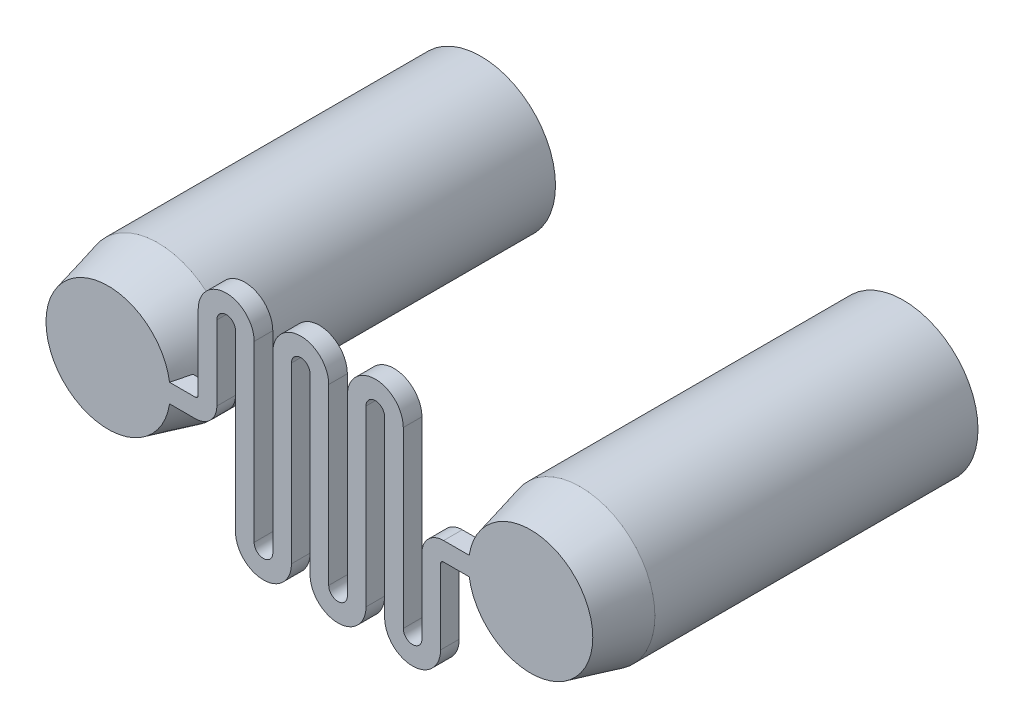
from build123d import *

# Parameters (mm, degrees)
BOSS_EXTRUDE1_DEPTH = 1.5
SKETCH5_R           = 5
CUT_EXTRUDE1_DEPTH  = 28


with BuildPart() as part:
    # Sketch2 → Boss-Extrude1 (new body)
    with BuildSketch(Plane.XY):
        with BuildLine():
            Line((-20.5, -0.75), (-13.5, -0.75))
            ThreePointArc((-13.5, -0.75), (-12.262563133, -0.237436867), (-11.75, 1))
            Line((-11.75, 1), (-11.75, 7))
            ThreePointArc((-11.75, 7), (-11, 7.75), (-10.25, 7))
            Line((-10.25, 7), (-10.25, 0))
            Line((-10.25, 0), (-10.25, -7))
            ThreePointArc((-10.25, -7), (-8, -9.25), (-5.75, -7))
            Line((-5.75, -7), (-5.75, 0))
            Line((-5.75, 0), (-5.75, 7))
            ThreePointArc((-5.75, 7), (-5, 7.75), (-4.25, 7))
            Line((-4.25, 7), (-4.25, 0))
            Line((-4.25, 0), (-4.25, -7))
            ThreePointArc((-4.25, -7), (-2, -9.25), (0.25, -7))
            Line((0.25, -7), (0.25, 0))
            Line((0.25, 0), (0.25, 7))
            ThreePointArc((0.25, 7), (1, 7.75), (1.75, 7))
            Line((1.75, 7), (1.75, 0))
            Line((1.75, 0), (1.75, -7))
            ThreePointArc((1.75, -7), (4, -9.25), (6.25, -7))
            Line((6.25, -7), (6.25, -1))
            ThreePointArc((6.25, -1), (6.323223305, -0.823223305), (6.5, -0.75))
            Line((6.5, -0.75), (13.5, -0.75))
            ThreePointArc((13.5, -0.75), (14.25, 0), (13.5, 0.75))
            Line((13.5, 0.75), (6.5, 0.75))
            ThreePointArc((6.5, 0.75), (5.262563133, 0.237436867), (4.75, -1))
            Line((4.75, -1), (4.75, -7))
            ThreePointArc((4.75, -7), (4, -7.75), (3.25, -7))
            Line((3.25, -7), (3.25, 0))
            Line((3.25, 0), (3.25, 7))
            ThreePointArc((3.25, 7), (1, 9.25), (-1.25, 7))
            Line((-1.25, 7), (-1.25, 0))
            Line((-1.25, 0), (-1.25, -7))
            ThreePointArc((-1.25, -7), (-2, -7.75), (-2.75, -7))
            Line((-2.75, -7), (-2.75, 0))
            Line((-2.75, 0), (-2.75, 7))
            ThreePointArc((-2.75, 7), (-5, 9.25), (-7.25, 7))
            Line((-7.25, 7), (-7.25, 0))
            Line((-7.25, 0), (-7.25, -7))
            ThreePointArc((-7.25, -7), (-8, -7.75), (-8.75, -7))
            Line((-8.75, -7), (-8.75, 0))
            Line((-8.75, 0), (-8.75, 7))
            ThreePointArc((-8.75, 7), (-11, 9.25), (-13.25, 7))
            Line((-13.25, 7), (-13.25, 1))
            ThreePointArc((-13.25, 1), (-13.323223305, 0.823223305), (-13.5, 0.75))
            Line((-13.5, 0.75), (-20.5, 0.75))
            ThreePointArc((-20.5, 0.75), (-21.25, 0), (-20.5, -0.75))
        make_face()
    extrude(amount=BOSS_EXTRUDE1_DEPTH)

    # Sketch3 → Revolve1 (revolve)
    with BuildSketch(Plane(origin=(0, 0, 0), x_dir=(1, 0, 0), z_dir=(0, 1, 0)), mode=Mode.PRIVATE) as revolve1_sk:
        Polygon((-20.5, -1.5), (-25.5, -1.5), (-26.5, 2.5), (-26.5, 28.5), (-20.5, 28.5), align=None)
    revolve(revolve1_sk.sketch.rotate(Axis((-20.5, 0, 1.5), (0, 0, -1)), 188.626926763), axis=Axis((-20.5, 0, 1.5), (0, 0, -1)))

    # Sketch4 → Revolve2 (revolve)
    with BuildSketch(Plane(origin=(0, 0, 0), x_dir=(1, 0, 0), z_dir=(0, 1, 0)), mode=Mode.PRIVATE) as revolve2_sk:
        Polygon((13.5, -1.5), (18.5, -1.5), (19.5, 2.5), (19.5, 28.5), (13.5, 28.5), align=None)
    revolve(revolve2_sk.sketch.rotate(Axis((13.5, 0, 1.5), (0, 0, -1)), 171.979067478), axis=Axis((13.5, 0, 1.5), (0, 0, -1)))

    # Sketch5 → Cut-Extrude1 (cut)
    with BuildSketch(Plane(origin=(0, 0, -28.5), x_dir=(-1, 0, 0), z_dir=(0, 0, -1))):
        with Locations((-13.5, 0)):
            Circle(SKETCH5_R)
        with Locations((20.5, 0)):
            Circle(SKETCH5_R)
    extrude(amount=-CUT_EXTRUDE1_DEPTH, mode=Mode.SUBTRACT)


solid = part.part
